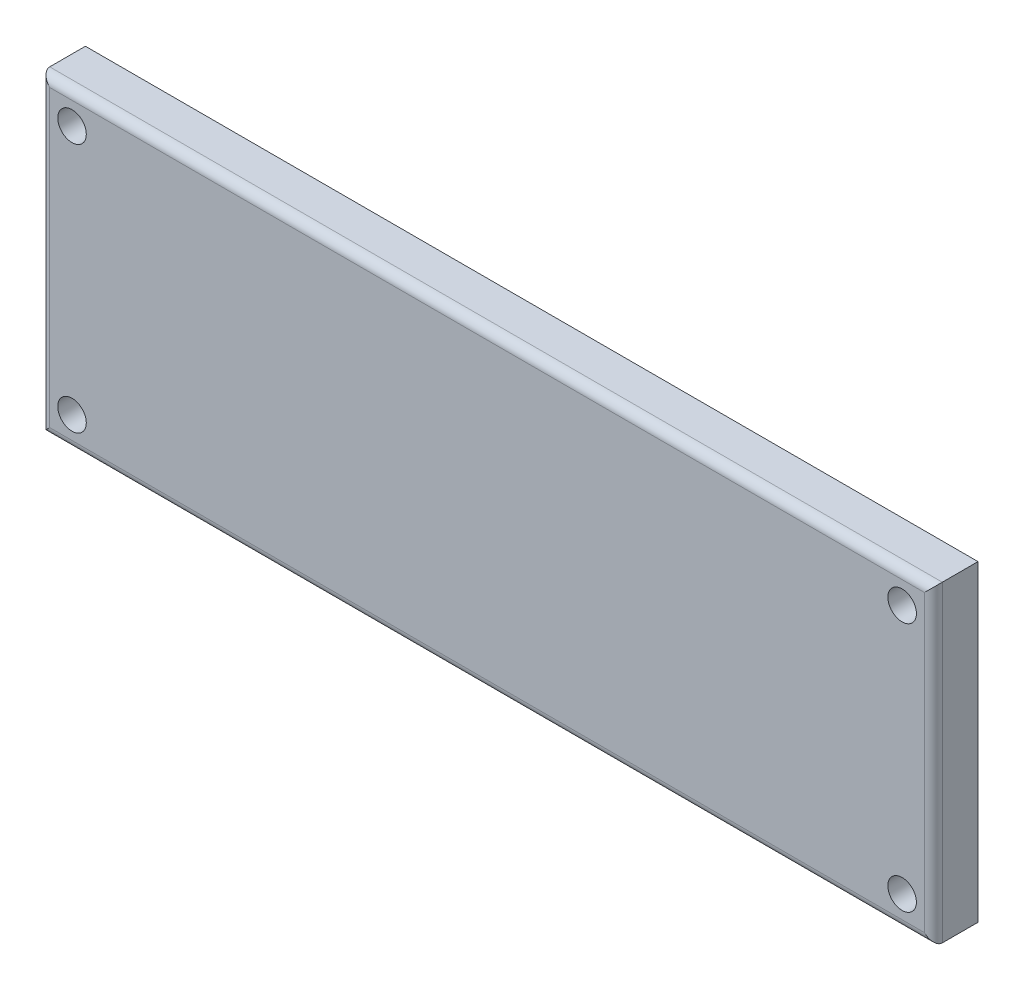
from build123d import *

# Parameters (mm, degrees)
SKETCH1_W           = 100
SKETCH1_H           = 35
BOSS_EXTRUDE1_DEPTH = 5
SKETCH2_R           = 1.6
CUT_EXTRUDE1_DEPTH  = 5
FILLET1_R           = 1


with BuildPart() as part:
    # Sketch1 → Boss-Extrude1 (new body)
    with BuildSketch(Plane.XY):
        Rectangle(SKETCH1_W, SKETCH1_H)
    extrude(amount=BOSS_EXTRUDE1_DEPTH)

    # Sketch2 → Cut-Extrude1 (cut)
    with BuildSketch(Plane.XY.offset(5)):
        with Locations((-46.5, 14)):
            Circle(SKETCH2_R)
        with Locations((-46.5, -14)):
            Circle(SKETCH2_R)
        with Locations((46.5, 14)):
            Circle(SKETCH2_R)
        with Locations((46.5, -14)):
            Circle(SKETCH2_R)
    extrude(amount=-CUT_EXTRUDE1_DEPTH, mode=Mode.SUBTRACT)

    # Fillet1
    fillet1_edges = [part.edges().sort_by_distance(p)[0] for p in [
        (50, 0, 5),
        (0, 17.5, 5),
        (-50, 0, 5),
        (0, -17.5, 5),
    ]]
    fillet(fillet1_edges, radius=FILLET1_R)


solid = part.part
